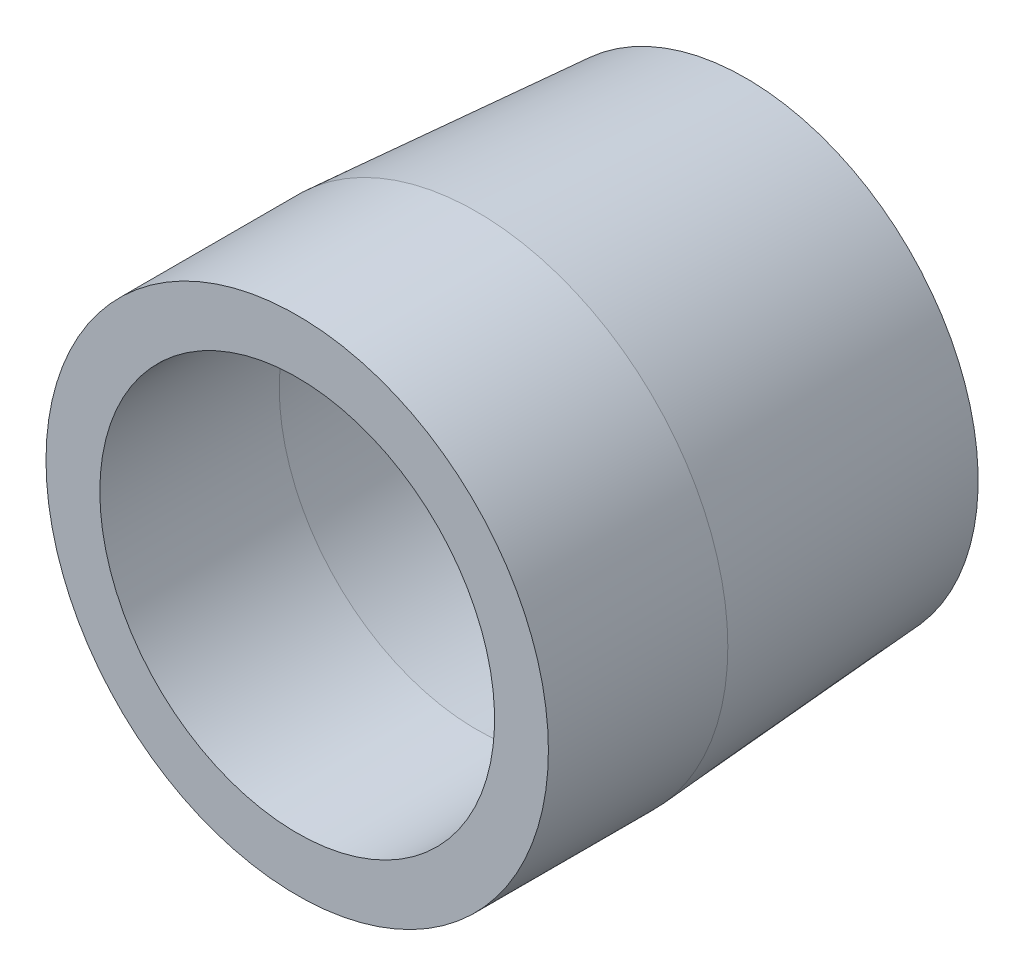
from build123d import *

# Parameters (mm, degrees)
ESQUISSE1_R             = 28
BOSS_EXTRU_1_DEPTH      = 20
ESQUISSE2_R             = 22
ENL_V_MAT_EXTRU_1_DEPTH = 20
ESQUISSE3_R             = 28
ESQUISSE3_R_2           = 22
BOSS_EXTRU_2_DEPTH      = 30
BOSS_EXTRU_2_DRAFT      = 4


with BuildPart() as part:
    # Esquisse1 → Boss.-Extru.1 (new body)
    with BuildSketch(Plane.XY):
        Circle(ESQUISSE1_R)
    extrude(amount=BOSS_EXTRU_1_DEPTH)

    # Esquisse2 → Enlèv. mat.-Extru.1 (cut)
    with BuildSketch(Plane(origin=(0, 0, 0), x_dir=(-1, 0, 0), z_dir=(0, 0, -1))):
        Circle(ESQUISSE2_R)
    extrude(amount=-ENL_V_MAT_EXTRU_1_DEPTH, mode=Mode.SUBTRACT)


with BuildPart() as boss_extru_2_tool:
    # Esquisse3 → Boss.-Extru.2 (with draft: the straight prism first)
    with BuildSketch(Plane(origin=(0, 0, 0), x_dir=(-1, 0, 0), z_dir=(0, 0, -1))):
        Circle(ESQUISSE3_R)
        Circle(ESQUISSE3_R_2, mode=Mode.SUBTRACT)
    extrude(amount=BOSS_EXTRU_2_DEPTH)
    # Boss.-Extru.2: the draft: its side faces are tilted about the plane it starts from
    boss_extru_2_sides = [boss_extru_2_tool.faces().sort_by_distance(p)[0] for p in [
        (28, 0, -15),
        (22, 0, -15),
    ]]
    draft(boss_extru_2_sides, Plane(origin=(0, 0, 0), x_dir=(-1, 0, 0), z_dir=(0, 0, -1)), BOSS_EXTRU_2_DRAFT)


with BuildPart() as part_1:
    add(part.part)

    # Boss.-Extru.2: add boss_extru_2_tool
    add(boss_extru_2_tool.part)


solid = part_1.part
